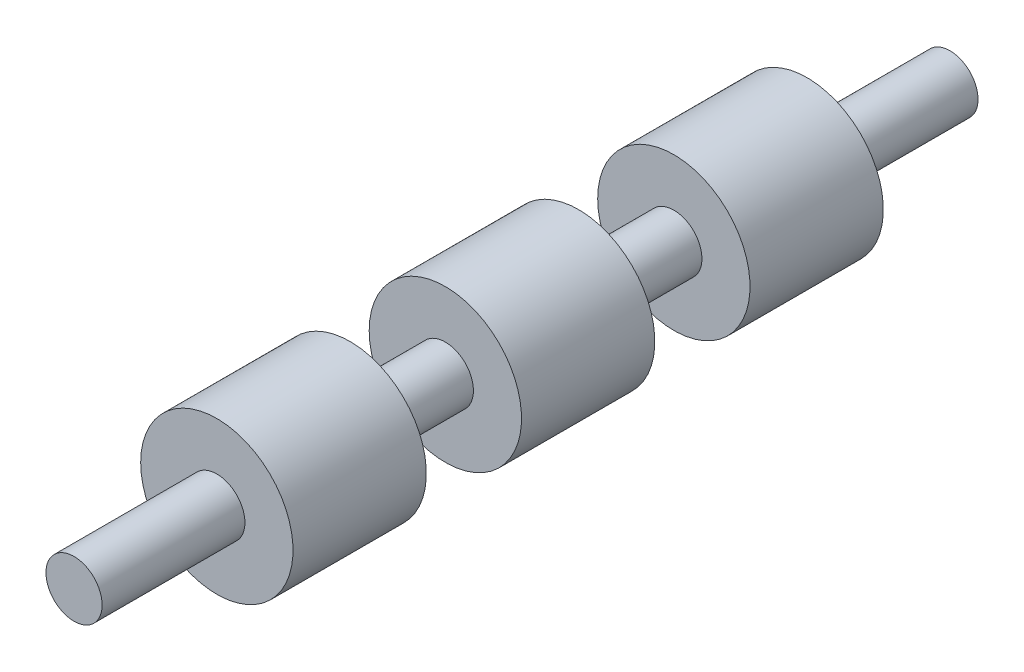
from build123d import *

# Parameters (mm, degrees)
CROQUIS1_R              = 2.95
SALIENTE_EXTRUIR1_DEPTH = 15
CROQUIS2_R              = 8
SALIENTE_EXTRUIR2_DEPTH = 14
SALIENTE_EXTRUIR3_START = 10
CROQUIS3_R              = 2.95
SALIENTE_EXTRUIR3_DEPTH = 10
CROQUIS4_R              = 8
SALIENTE_EXTRUIR4_DEPTH = 14
SALIENTE_EXTRUIR5_START = 10
CROQUIS5_R              = 2.95
SALIENTE_EXTRUIR5_DEPTH = 10
CROQUIS6_R              = 8
SALIENTE_EXTRUIR6_DEPTH = 14
SALIENTE_EXTRUIR7_START = 15
CROQUIS7_R              = 2.95
SALIENTE_EXTRUIR7_DEPTH = 15


with BuildPart() as part:
    # Croquis1 → Saliente-Extruir1 (new body)
    with BuildSketch(Plane.XY):
        Circle(CROQUIS1_R)
    extrude(amount=SALIENTE_EXTRUIR1_DEPTH)

    # Croquis2 → Saliente-Extruir2 (add)
    with BuildSketch(Plane(origin=(0, 0, 0), x_dir=(-1, 0, 0), z_dir=(0, 0, -1))):
        Circle(CROQUIS2_R)
    extrude(amount=SALIENTE_EXTRUIR2_DEPTH)

    # Croquis3 → Saliente-Extruir3 (add)
    with BuildSketch(Plane(origin=(0, 0, -14), x_dir=(-1, 0, 0), z_dir=(0, 0, -1)).offset(SALIENTE_EXTRUIR3_START)):
        with Locations(Location((0, 0, 0), (0, 0, 180))):
            Circle(CROQUIS3_R)
    extrude(amount=-SALIENTE_EXTRUIR3_DEPTH)

    # Croquis4 → Saliente-Extruir4 (add)
    with BuildSketch(Plane(origin=(0, 0, -24), x_dir=(-1, 0, 0), z_dir=(0, 0, -1))):
        Circle(CROQUIS4_R)
    extrude(amount=SALIENTE_EXTRUIR4_DEPTH)

    # Croquis5 → Saliente-Extruir5 (add)
    with BuildSketch(Plane(origin=(0, 0, -38), x_dir=(-1, 0, 0), z_dir=(0, 0, -1)).offset(SALIENTE_EXTRUIR5_START)):
        with Locations(Location((0, 0, 0), (0, 0, 180))):
            Circle(CROQUIS5_R)
    extrude(amount=-SALIENTE_EXTRUIR5_DEPTH)

    # Croquis6 → Saliente-Extruir6 (add)
    with BuildSketch(Plane(origin=(0, 0, -48), x_dir=(-1, 0, 0), z_dir=(0, 0, -1))):
        Circle(CROQUIS6_R)
    extrude(amount=SALIENTE_EXTRUIR6_DEPTH)

    # Croquis7 → Saliente-Extruir7 (add)
    with BuildSketch(Plane(origin=(0, 0, -62), x_dir=(-1, 0, 0), z_dir=(0, 0, -1)).offset(SALIENTE_EXTRUIR7_START)):
        with Locations(Location((0, 0, 0), (0, 0, 180))):
            Circle(CROQUIS7_R)
    extrude(amount=-SALIENTE_EXTRUIR7_DEPTH)


solid = part.part
